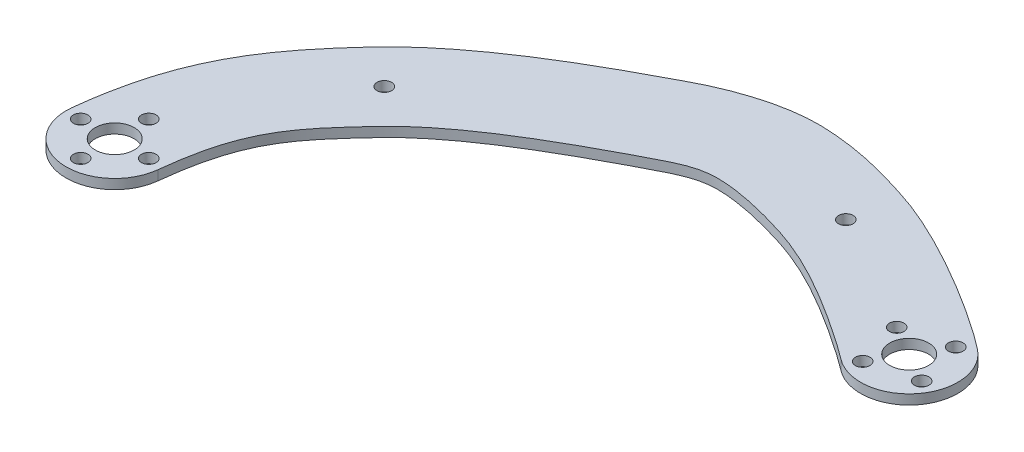
from build123d import *

# Parameters (mm, degrees)
BOSS_EXTRUDE1_DEPTH      = 2
F_8_0_8_DIAMETER_HOLE1_D = 8
F_3_0_3_DIAMETER_HOLE1_D = 3


with BuildPart() as part:
    # Sketch1 → Boss-Extrude1 (new body)
    with BuildSketch(Plane(origin=(0, 0, 0), x_dir=(1, 0, 0), z_dir=(0, 1, 0))):
        with BuildLine():
            ThreePointArc((-104.939991114, 1.093881459), (-96.093881459, -9.939991114), (-85.060008886, -1.093881459))
            add(Edge.make_bspline(
                [(-85.060008886, -1.093881459), (-83.273393087, 15.140917124), (-78.495416835, 20.249144447), (-62.010196397, 38.064183613), (-47.279984765, 45.957396679), (-31.234285538, 54.325875613), (-28.950983754, 55.112801628), (-20.553468412, 54.701300001), (-14.792106129, 53.265844651), (-5.22837928, 50.174062031), (-0.197175706, 47.761705183), (11.58434645, 40.663439077), (17.421875589, 36.549367368), (18.782029269, 35.46948623)],
                knots=[0, 0, 0, 0, 0.25, 0.25, 0.5, 0.5, 0.625, 0.625, 0.75, 0.75, 0.875, 0.875, 1, 1, 1, 1], degree=3))
            ThreePointArc((18.782029269, 35.46948623), (32.831783959, 37.083299458), (31.217970731, 51.133054149))
            add(Edge.make_bspline(
                [(31.217970731, 51.133054149), (25.201455691, 55.909809307), (8.344450809, 66.780350502), (-9.954523595, 72.736854126), (-16.066151794, 74.513601783), (-31.494629212, 75.249713148), (-39.748131289, 72.452828276), (-57.989238736, 62.908327663), (-74.514887154, 54.009021322), (-95.36122963, 31.457428955), (-102.721578546, 21.252373986), (-104.939991114, 1.093881459)],
                knots=[0, 0, 0, 0, 0.25, 0.25, 0.375, 0.375, 0.5, 0.5, 0.75, 0.75, 1, 1, 1, 1], degree=3))
        make_face()
    extrude(amount=-BOSS_EXTRUDE1_DEPTH)

    # Ø8.0 (8) Diameter Hole1 (through all)
    with Locations(Plane(origin=(0, 0, 0), x_dir=(1, 0, 0), z_dir=(0, 1, 0))):
        with Locations((-95, 0), (25, 43.301270189)):
            Hole(F_8_0_8_DIAMETER_HOLE1_D / 2)

    # Ø3.0 (3) Diameter Hole1 (through all)
    with Locations(Plane(origin=(0, 0, 0), x_dir=(1, 0, 0), z_dir=(0, 1, 0))):
        with Locations((-76.597395631, 37.006233127), (-5.470404833, 60.745850477), (31.062177826, 39.801270189), (-88, 0), (-102, 0), (21.5, 37.239092363), (28.5, 49.363448016), (-95, 7), (-95, -7), (18.937822174, 46.801270189)):
            Hole(F_3_0_3_DIAMETER_HOLE1_D / 2)


solid = part.part
